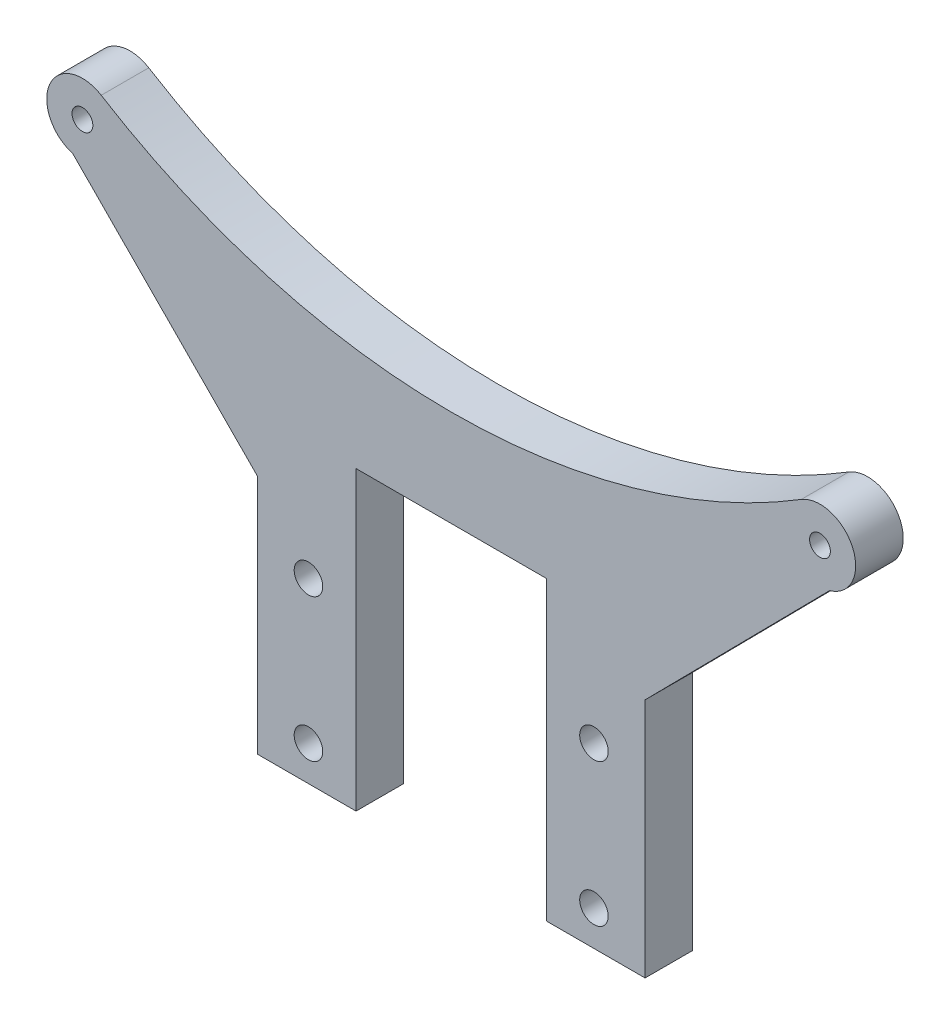
from build123d import *

# Parameters (mm, degrees)
SKETCH1_R           = 1.905
SKETCH1_R_2         = 1.3890625
BOSS_EXTRUDE1_DEPTH = 6.35


with BuildPart() as part:
    # Sketch1 → Boss-Extrude1 (new body)
    with BuildSketch(Plane.XY):
        with BuildLine():
            Line((12.7, 0), (-12.7, 0))
            Line((-12.7, 0), (-12.7, -39.593860647))
            Line((-12.7, -39.593860647), (-25.872163348, -39.593860647))
            Line((-25.872163348, -39.593860647), (-25.872163348, -7.44555378))
            Line((-25.872163348, -7.44555378), (-50.502986928, 17.497884605))
            ThreePointArc((-50.502986928, 17.497884605), (-53.573053894, 23.997146119), (-46.71026588, 26.134399514))
            ThreePointArc((-46.71026588, 26.134399514), (0, 12.874711135), (46.71026588, 26.134399514))
            ThreePointArc((46.71026588, 26.134399514), (53.573053894, 23.997146119), (50.502986928, 17.497884605))
            Line((50.502986928, 17.497884605), (25.872163348, -7.44555378))
            Line((25.872163348, -7.44555378), (25.872163348, -39.593860647))
            Line((25.872163348, -39.593860647), (12.7, -39.593860647))
            Line((12.7, -39.593860647), (12.7, 0))
        make_face()
        with Locations((-19.05, -15.875)):
            Circle(SKETCH1_R, mode=Mode.SUBTRACT)
        with Locations(Location((19.05, -15.875, 0), (0, 0, 180))):
            Circle(SKETCH1_R, mode=Mode.SUBTRACT)
        with Locations((-49.2125, 22.082211135)):
            Circle(SKETCH1_R_2, mode=Mode.SUBTRACT)
        with Locations((-19.05, -34.925)):
            Circle(SKETCH1_R, mode=Mode.SUBTRACT)
        with Locations(Location((19.05, -34.925, 0), (0, 0, 180))):
            Circle(SKETCH1_R, mode=Mode.SUBTRACT)
        with Locations(Location((49.2125, 22.082211135, 0), (0, 0, 180))):
            Circle(SKETCH1_R_2, mode=Mode.SUBTRACT)
    extrude(amount=BOSS_EXTRUDE1_DEPTH)


solid = part.part
